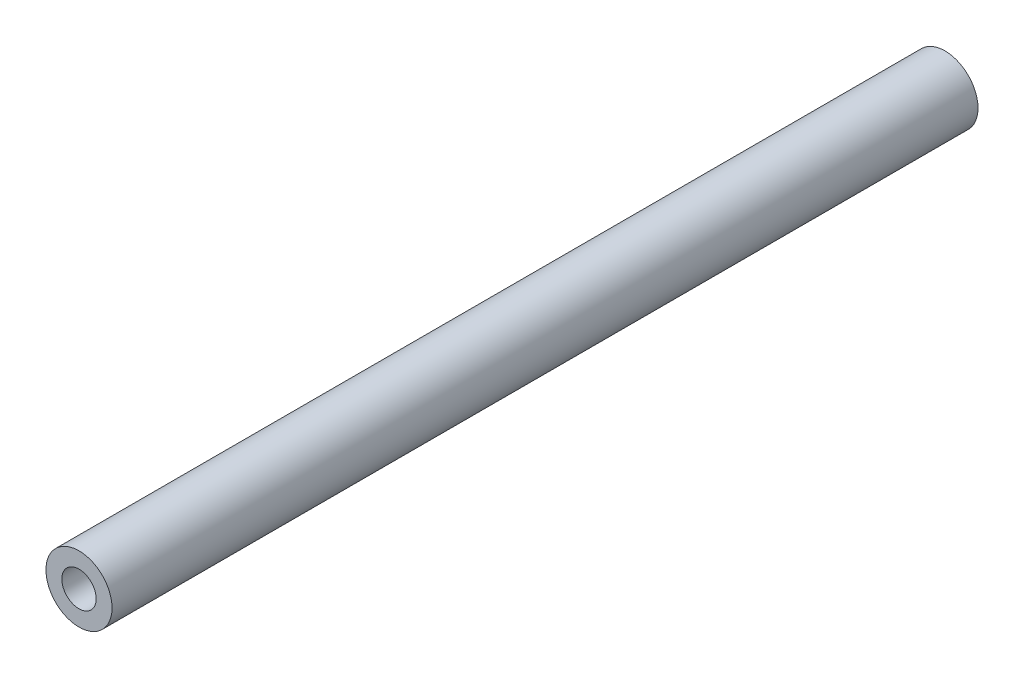
from build123d import *

# Parameters (mm, degrees)
SKETCH1_R                 = 2.5
BOSS_EXTRUDE1_DEPTH       = 65.5
M3X0_5_TAPPED_HOLE1_D     = 2.6
M3X0_5_TAPPED_HOLE1_DEPTH = 8
M3X0_5_TAPPED_HOLE1_TIP   = 0.781118805
M3X0_5_TAPPED_HOLE2_D     = 2.6
M3X0_5_TAPPED_HOLE2_DEPTH = 8
M3X0_5_TAPPED_HOLE2_TIP   = 0.781118805


with BuildPart() as part:
    # Sketch1 → Boss-Extrude1 (new body)
    with BuildSketch(Plane.XY):
        Circle(SKETCH1_R)
    extrude(amount=BOSS_EXTRUDE1_DEPTH)

    # M3x0.5 Tapped Hole1
    with Locations(Plane.XY.offset(65.5)):
        with Locations((0, 0)):
            Hole(M3X0_5_TAPPED_HOLE1_D / 2, depth=M3X0_5_TAPPED_HOLE1_DEPTH)
            with Locations((0, 0, -(M3X0_5_TAPPED_HOLE1_DEPTH + M3X0_5_TAPPED_HOLE1_TIP / 2))):  # 118° drill point
                Cone(0, M3X0_5_TAPPED_HOLE1_D / 2, M3X0_5_TAPPED_HOLE1_TIP, mode=Mode.SUBTRACT)

    # M3x0.5 Tapped Hole2
    with Locations(Plane(origin=(0, 0, 0), x_dir=(-1, 0, 0), z_dir=(0, 0, -1))):
        with Locations((0, 0)):
            Hole(M3X0_5_TAPPED_HOLE2_D / 2, depth=M3X0_5_TAPPED_HOLE2_DEPTH)
            with Locations((0, 0, -(M3X0_5_TAPPED_HOLE2_DEPTH + M3X0_5_TAPPED_HOLE2_TIP / 2))):  # 118° drill point
                Cone(0, M3X0_5_TAPPED_HOLE2_D / 2, M3X0_5_TAPPED_HOLE2_TIP, mode=Mode.SUBTRACT)


solid = part.part
